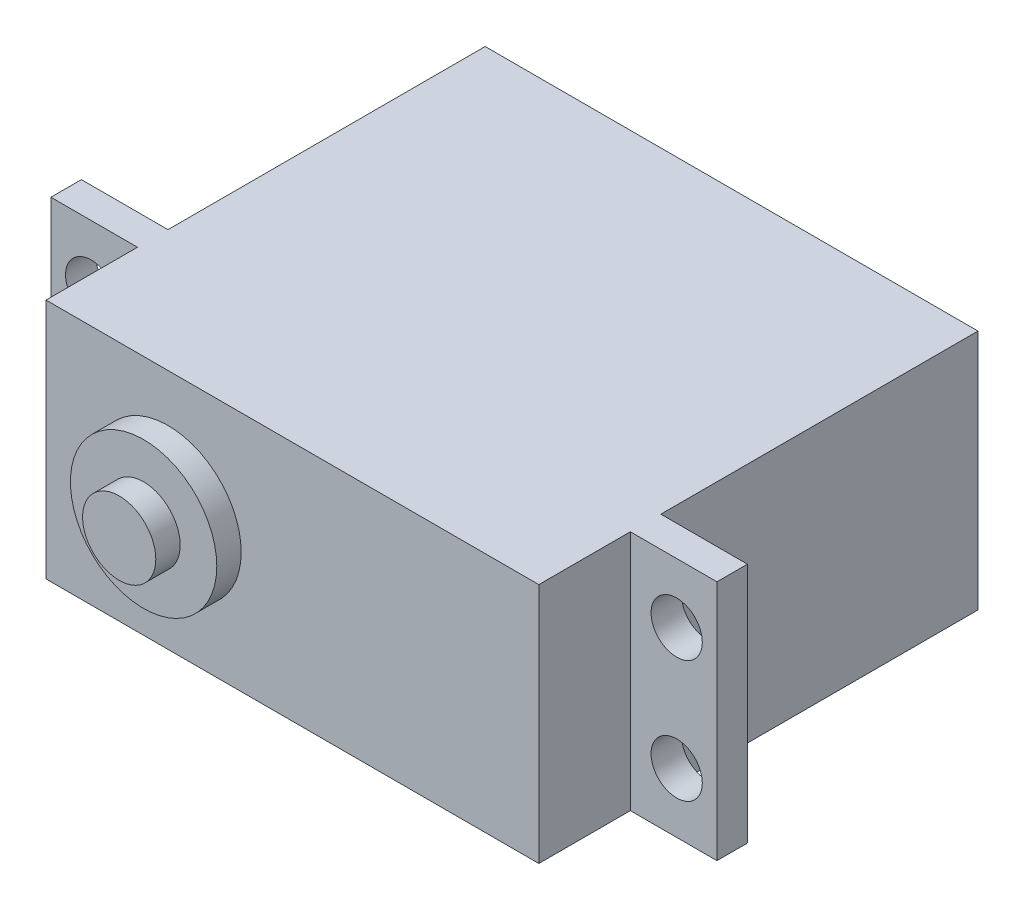
from build123d import *

# Parameters (mm, degrees)
BOSS_EXTRUDE1_DEPTH      = 10
BOSS_EXTRUDE1_DEPTH_BACK = 26
SKETCH1_W                = 40.4
SKETCH1_H                = 19.8
SKETCH2_W                = 7.1
SKETCH2_H                = 19.8
SKETCH2_R                = 2.1
BOSS_EXTRUDE2_DEPTH      = 2.5
SKETCH3_W                = 7.1
SKETCH3_H                = 19.8
SKETCH3_R                = 2.1
BOSS_EXTRUDE3_DEPTH      = 2.5
BOSS_EXTRUDE4_START      = 10
SKETCH4_R                = 6
BOSS_EXTRUDE4_DEPTH      = 2
BOSS_EXTRUDE5_START      = 12
SKETCH5_R                = 3
BOSS_EXTRUDE5_DEPTH      = 2


with BuildPart() as part:
    # Sketch1 → Boss-Extrude1 (new, two sides: drawn at the far end of the back side and taken through both)
    with BuildSketch(Plane.XY.offset(-BOSS_EXTRUDE1_DEPTH_BACK)):
        with Locations((10.2, 0)):
            Rectangle(SKETCH1_W, SKETCH1_H)
    extrude(amount=BOSS_EXTRUDE1_DEPTH + BOSS_EXTRUDE1_DEPTH_BACK)

    # Sketch2 → Boss-Extrude2 (add)
    with BuildSketch(Plane.XY):
        with Locations((-13.55, 0)):
            Rectangle(SKETCH2_W, SKETCH2_H)
        with Locations((-13.8, 5)):
            Circle(SKETCH2_R, mode=Mode.SUBTRACT)
        with Locations((-13.8, -5)):
            Circle(SKETCH2_R, mode=Mode.SUBTRACT)
    extrude(amount=BOSS_EXTRUDE2_DEPTH)

    # Sketch3 → Boss-Extrude3 (add)
    with BuildSketch(Plane.XY):
        with Locations((33.95, 0)):
            Rectangle(SKETCH3_W, SKETCH3_H)
        with Locations((34.2, 5)):
            Circle(SKETCH3_R, mode=Mode.SUBTRACT)
        with Locations((34.2, -5)):
            Circle(SKETCH3_R, mode=Mode.SUBTRACT)
    extrude(amount=BOSS_EXTRUDE3_DEPTH)

    # Sketch4 → Boss-Extrude4 (add)
    with BuildSketch(Plane.XY.offset(BOSS_EXTRUDE4_START)):
        Circle(SKETCH4_R)
    extrude(amount=BOSS_EXTRUDE4_DEPTH)

    # Sketch5 → Boss-Extrude5 (add)
    with BuildSketch(Plane.XY.offset(BOSS_EXTRUDE5_START)):
        Circle(SKETCH5_R)
    extrude(amount=BOSS_EXTRUDE5_DEPTH)


solid = part.part
